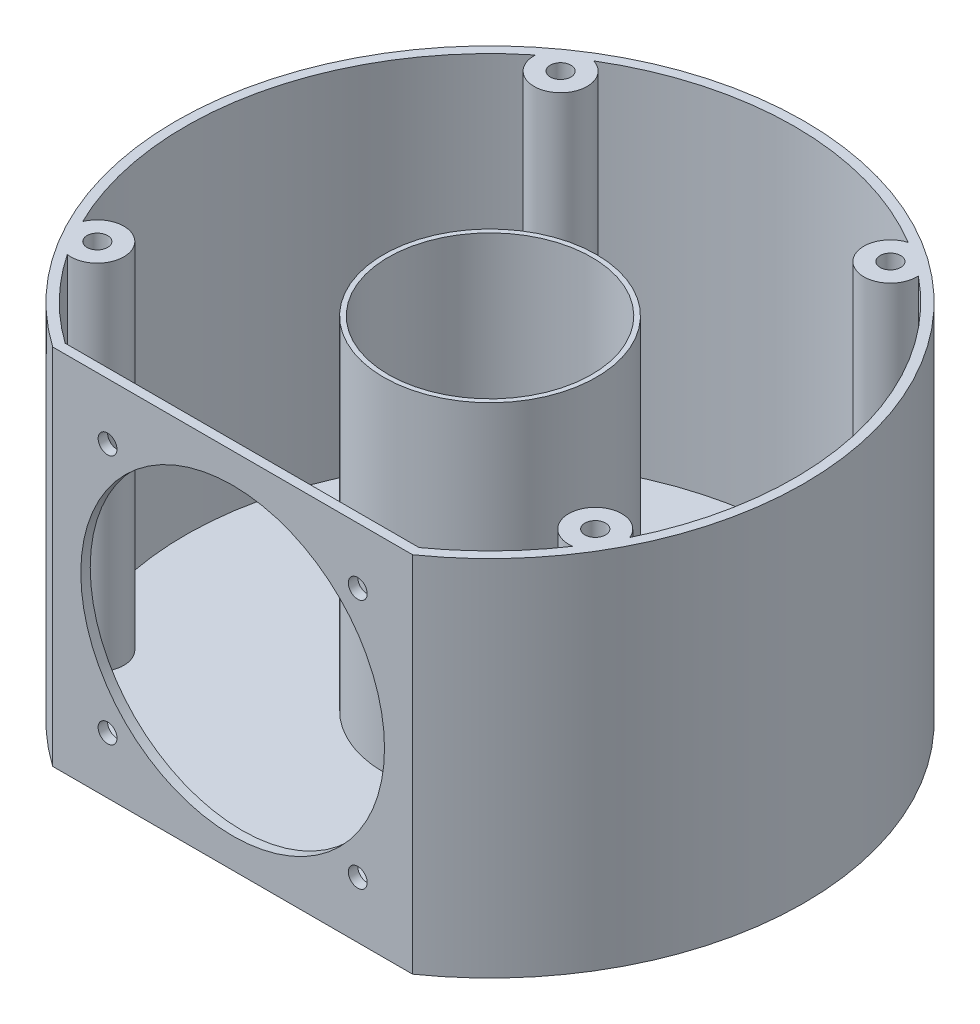
from build123d import *

# Parameters (mm, degrees)
BASE_R              = 17.241713529
BOSS_EXTRUDE4_DEPTH = 1.6
SKETCH7_R           = 18.041713529
SKETCH7_R_2         = 17.241713529
BOSS_EXTRUDE5_DEPTH = 60
HORN_SCREWS_REACH   = 116.767
SKETCH8_R           = 1.6
HORN_REACH          = 128.56
SKETCH18_R          = 25.75
SKETCH12_R          = 4.5
PCB_SCREWS_DEPTH    = 61.6
CUT_EXTRUDE1_REACH  = 99.289
SKETCH21_R          = 3.25
BOSS_EXTRUDE6_START = -4
SKETCH20_R          = 4.5
SKETCH20_R_2        = 1.75
BOSS_EXTRUDE6_DEPTH = 4
MAST_START          = -2
SKETCH19_R          = 18.041713529
MAST_DEPTH          = 2


with BuildPart() as part:
    # Base (on Top Plane) → Boss-Extrude4 (new body)
    with BuildSketch(Plane(origin=(0, 0, 0), x_dir=(1, 0, 0), z_dir=(0, 1, 0))):
        with BuildLine():
            Line((-30.508028449, -43.641713529), (30.508028449, -43.641713529))
            ThreePointArc((30.508028449, -43.641713529), (0, 53.247900988), (-30.508028449, -43.641713529))
        make_face()
        with Locations(Location((0, 0, 0), (0, 0, 270))):
            Circle(BASE_R, mode=Mode.SUBTRACT)
    extrude(amount=BOSS_EXTRUDE4_DEPTH)

    # Sketch7 → Boss-Extrude5 (add)
    # profile 1 of 5: a face of its own
    with BuildSketch(Plane(origin=(0, 1.6, 0), x_dir=(1, 0, 0), z_dir=(0, 1, 0))):
        with BuildLine():
            ThreePointArc((30.508028449, -43.641713529), (0, 53.247900988), (-30.508028449, -43.641713529))
            Line((-30.508028449, -43.641713529), (30.508028449, -43.641713529))
        make_face()
        with BuildLine():
            Line((30, -42.041713529), (-30, -42.041713529))
            ThreePointArc((-30, -42.041713529), (0, 51.647900988), (30, -42.041713529))
        make_face(mode=Mode.SUBTRACT)
    # profile 2 of 5: a face of its own
    with BuildSketch(Plane(origin=(0, 1.6, 0), x_dir=(1, 0, 0), z_dir=(0, 1, 0))):
        with BuildLine():
            ThreePointArc((30.508028449, -43.641713529), (0, 53.247900988), (-30.508028449, -43.641713529))
            Line((-30.508028449, -43.641713529), (30.508028449, -43.641713529))
        make_face()
        with BuildLine():
            Line((30, -42.041713529), (-30, -42.041713529))
            ThreePointArc((-30, -42.041713529), (0, 51.647900988), (30, -42.041713529))
        make_face(mode=Mode.SUBTRACT)
    # profile 3 of 5: a face of its own
    with BuildSketch(Plane(origin=(0, 1.6, 0), x_dir=(1, 0, 0), z_dir=(0, 1, 0))):
        with BuildLine():
            ThreePointArc((30.508028449, -43.641713529), (0, 53.247900988), (-30.508028449, -43.641713529))
            Line((-30.508028449, -43.641713529), (30.508028449, -43.641713529))
        make_face()
        with BuildLine():
            Line((30, -42.041713529), (-30, -42.041713529))
            ThreePointArc((-30, -42.041713529), (0, 51.647900988), (30, -42.041713529))
        make_face(mode=Mode.SUBTRACT)
    # profile 4 of 5: a face of its own
    with BuildSketch(Plane(origin=(0, 1.6, 0), x_dir=(1, 0, 0), z_dir=(0, 1, 0))):
        with BuildLine():
            ThreePointArc((30.508028449, -43.641713529), (0, 53.247900988), (-30.508028449, -43.641713529))
            Line((-30.508028449, -43.641713529), (30.508028449, -43.641713529))
        make_face()
        with BuildLine():
            Line((30, -42.041713529), (-30, -42.041713529))
            ThreePointArc((-30, -42.041713529), (0, 51.647900988), (30, -42.041713529))
        make_face(mode=Mode.SUBTRACT)
    # profile 5 of 5: a face of its own
    with BuildSketch(Plane(origin=(0, 1.6, 0), x_dir=(1, 0, 0), z_dir=(0, 1, 0))):
        with Locations(Location((0, 0, 0), (0, 0, 270))):
            Circle(SKETCH7_R)
        with Locations(Location((0, 0, 0), (0, 0, 270))):
            Circle(SKETCH7_R_2, mode=Mode.SUBTRACT)
    extrude(amount=BOSS_EXTRUDE5_DEPTH)

    # Sketch8 → Horn screws (cut, up to next)
    with BuildSketch(Plane(origin=(0, 30.8, 43.641713529), x_dir=(-1, 0, 0), z_dir=(0, 0, -1)), mode=Mode.PRIVATE) as horn_screws_sk1:
        with Locations(Location((21.213203436, -21.213203436, 0), (0, 0, 180))):
            Circle(SKETCH8_R)
    horn_screws_tool1 = extrude(horn_screws_sk1.sketch, amount=HORN_SCREWS_REACH, mode=Mode.PRIVATE) & part.part
    # Sketch8 → Horn screws (cut, up to next)
    with BuildSketch(Plane(origin=(0, 30.8, 43.641713529), x_dir=(-1, 0, 0), z_dir=(0, 0, -1)), mode=Mode.PRIVATE) as horn_screws_sk2:
        with Locations(Location((-21.213203436, -21.213203436, 0), (0, 0, 180))):
            Circle(SKETCH8_R)
    horn_screws_tool2 = extrude(horn_screws_sk2.sketch, amount=HORN_SCREWS_REACH, mode=Mode.PRIVATE) & part.part
    # Sketch8 → Horn screws (cut, up to next)
    with BuildSketch(Plane(origin=(0, 30.8, 43.641713529), x_dir=(-1, 0, 0), z_dir=(0, 0, -1)), mode=Mode.PRIVATE) as horn_screws_sk3:
        with Locations(Location((-21.213203436, 21.213203436, 0), (0, 0, 180))):
            Circle(SKETCH8_R)
    horn_screws_tool3 = extrude(horn_screws_sk3.sketch, amount=HORN_SCREWS_REACH, mode=Mode.PRIVATE) & part.part
    # Sketch8 → Horn screws (cut, up to next)
    with BuildSketch(Plane(origin=(0, 30.8, 43.641713529), x_dir=(-1, 0, 0), z_dir=(0, 0, -1)), mode=Mode.PRIVATE) as horn_screws_sk4:
        with Locations(Location((21.213203436, 21.213203436, 0), (0, 0, 180))):
            Circle(SKETCH8_R)
    horn_screws_tool4 = extrude(horn_screws_sk4.sketch, amount=HORN_SCREWS_REACH, mode=Mode.PRIVATE) & part.part
    add(horn_screws_tool1.solids().sort_by_distance((-21.213203, 9.586797, 43.641714))[0], mode=Mode.SUBTRACT)
    add(horn_screws_tool2.solids().sort_by_distance((21.213203, 9.586797, 43.641714))[0], mode=Mode.SUBTRACT)
    add(horn_screws_tool3.solids().sort_by_distance((21.213203, 52.013203, 43.641714))[0], mode=Mode.SUBTRACT)
    add(horn_screws_tool4.solids().sort_by_distance((-21.213203, 52.013203, 43.641714))[0], mode=Mode.SUBTRACT)

    # Sketch18 → Horn (cut, up to next)
    with BuildSketch(Plane.XY.offset(43.641713529), mode=Mode.PRIVATE) as horn_sk1:
        with Locations((0, 30.8)):
            Circle(SKETCH18_R)
    horn_tool1 = extrude(horn_sk1.sketch, amount=-HORN_REACH, mode=Mode.PRIVATE) & part.part
    add(horn_tool1.solids().sort_by_distance((0, 30.8, 43.641714))[0], mode=Mode.SUBTRACT)

    # Sketch12 → PCB screws (add)
    with BuildSketch(Plane.XZ):
        with Locations((-42.216920637, 24.373950494)):
            Circle(SKETCH12_R)
        with Locations((-27.960647328, -39.931942749)):
            Circle(SKETCH12_R)
        with Locations((27.960647328, -39.931942749)):
            Circle(SKETCH12_R)
        with Locations((42.216920637, 24.373950494)):
            Circle(SKETCH12_R)
    extrude(amount=-PCB_SCREWS_DEPTH)

    # Sketch21 → Cut-Extrude1 (cut, up to next)
    with BuildSketch(Plane(origin=(0, 0, 0), x_dir=(1, 0, 0), z_dir=(0, 1, 0)), mode=Mode.PRIVATE) as cut_extrude1_sk1:
        with Locations(Location((-42.216920637, -24.373950494, 0), (0, 0, 270))):
            Circle(SKETCH21_R)
    cut_extrude1_tool1 = extrude(cut_extrude1_sk1.sketch, amount=CUT_EXTRUDE1_REACH, mode=Mode.PRIVATE) & part.part
    # Sketch21 → Cut-Extrude1 (cut, up to next)
    with BuildSketch(Plane(origin=(0, 0, 0), x_dir=(1, 0, 0), z_dir=(0, 1, 0)), mode=Mode.PRIVATE) as cut_extrude1_sk2:
        with Locations(Location((42.216920637, -24.373950494, 0), (0, 0, 270))):
            Circle(SKETCH21_R)
    cut_extrude1_tool2 = extrude(cut_extrude1_sk2.sketch, amount=CUT_EXTRUDE1_REACH, mode=Mode.PRIVATE) & part.part
    # Sketch21 → Cut-Extrude1 (cut, up to next)
    with BuildSketch(Plane(origin=(0, 0, 0), x_dir=(1, 0, 0), z_dir=(0, 1, 0)), mode=Mode.PRIVATE) as cut_extrude1_sk3:
        with Locations(Location((27.960647328, 39.931942749, 0), (0, 0, 270))):
            Circle(SKETCH21_R)
    cut_extrude1_tool3 = extrude(cut_extrude1_sk3.sketch, amount=CUT_EXTRUDE1_REACH, mode=Mode.PRIVATE) & part.part
    # Sketch21 → Cut-Extrude1 (cut, up to next)
    with BuildSketch(Plane(origin=(0, 0, 0), x_dir=(1, 0, 0), z_dir=(0, 1, 0)), mode=Mode.PRIVATE) as cut_extrude1_sk4:
        with Locations(Location((-27.960647328, 39.931942749, 0), (0, 0, 270))):
            Circle(SKETCH21_R)
    cut_extrude1_tool4 = extrude(cut_extrude1_sk4.sketch, amount=CUT_EXTRUDE1_REACH, mode=Mode.PRIVATE) & part.part
    add(cut_extrude1_tool1.solids().sort_by_distance((-42.216921, 0, 24.37395))[0], mode=Mode.SUBTRACT)
    add(cut_extrude1_tool2.solids().sort_by_distance((42.216921, 0, 24.37395))[0], mode=Mode.SUBTRACT)
    add(cut_extrude1_tool3.solids().sort_by_distance((27.960647, 0, -39.931943))[0], mode=Mode.SUBTRACT)
    add(cut_extrude1_tool4.solids().sort_by_distance((-27.960647, 0, -39.931943))[0], mode=Mode.SUBTRACT)

    # Sketch20 → Boss-Extrude6 (add)
    # profile 1 of 4: a face of its own
    with BuildSketch(Plane(origin=(0, 61.6, 0), x_dir=(1, 0, 0), z_dir=(0, 1, 0)).offset(BOSS_EXTRUDE6_START)):
        with Locations((-42.216920637, -24.373950494)):
            Circle(SKETCH20_R)
        with Locations(Location((-42.216920637, -24.373950494, 0), (0, 0, 270))):
            Circle(SKETCH20_R_2, mode=Mode.SUBTRACT)
    # profile 2 of 4: a face of its own
    with BuildSketch(Plane(origin=(0, 61.6, 0), x_dir=(1, 0, 0), z_dir=(0, 1, 0)).offset(BOSS_EXTRUDE6_START)):
        with Locations((42.216920637, -24.373950494)):
            Circle(SKETCH20_R)
        with Locations(Location((42.216920637, -24.373950494, 0), (0, 0, 270))):
            Circle(SKETCH20_R_2, mode=Mode.SUBTRACT)
    # profile 3 of 4: a face of its own
    with BuildSketch(Plane(origin=(0, 61.6, 0), x_dir=(1, 0, 0), z_dir=(0, 1, 0)).offset(BOSS_EXTRUDE6_START)):
        with Locations((27.960647328, 39.931942749)):
            Circle(SKETCH20_R)
        with Locations(Location((27.960647328, 39.931942749, 0), (0, 0, 270))):
            Circle(SKETCH20_R_2, mode=Mode.SUBTRACT)
    # profile 4 of 4: a face of its own
    with BuildSketch(Plane(origin=(0, 61.6, 0), x_dir=(1, 0, 0), z_dir=(0, 1, 0)).offset(BOSS_EXTRUDE6_START)):
        with Locations((-27.960647328, 39.931942749)):
            Circle(SKETCH20_R)
        with Locations(Location((-27.960647328, 39.931942749, 0), (0, 0, 270))):
            Circle(SKETCH20_R_2, mode=Mode.SUBTRACT)
    extrude(amount=BOSS_EXTRUDE6_DEPTH)

    # Sketch19 → Mast (cut)
    with BuildSketch(Plane(origin=(0, 61.6, 0), x_dir=(1, 0, 0), z_dir=(0, 1, 0)).offset(MAST_START)):
        with Locations(Location((0, 0, 0), (0, 0, 270))):
            Circle(SKETCH19_R)
    extrude(amount=MAST_DEPTH, mode=Mode.SUBTRACT)


solid = part.part
